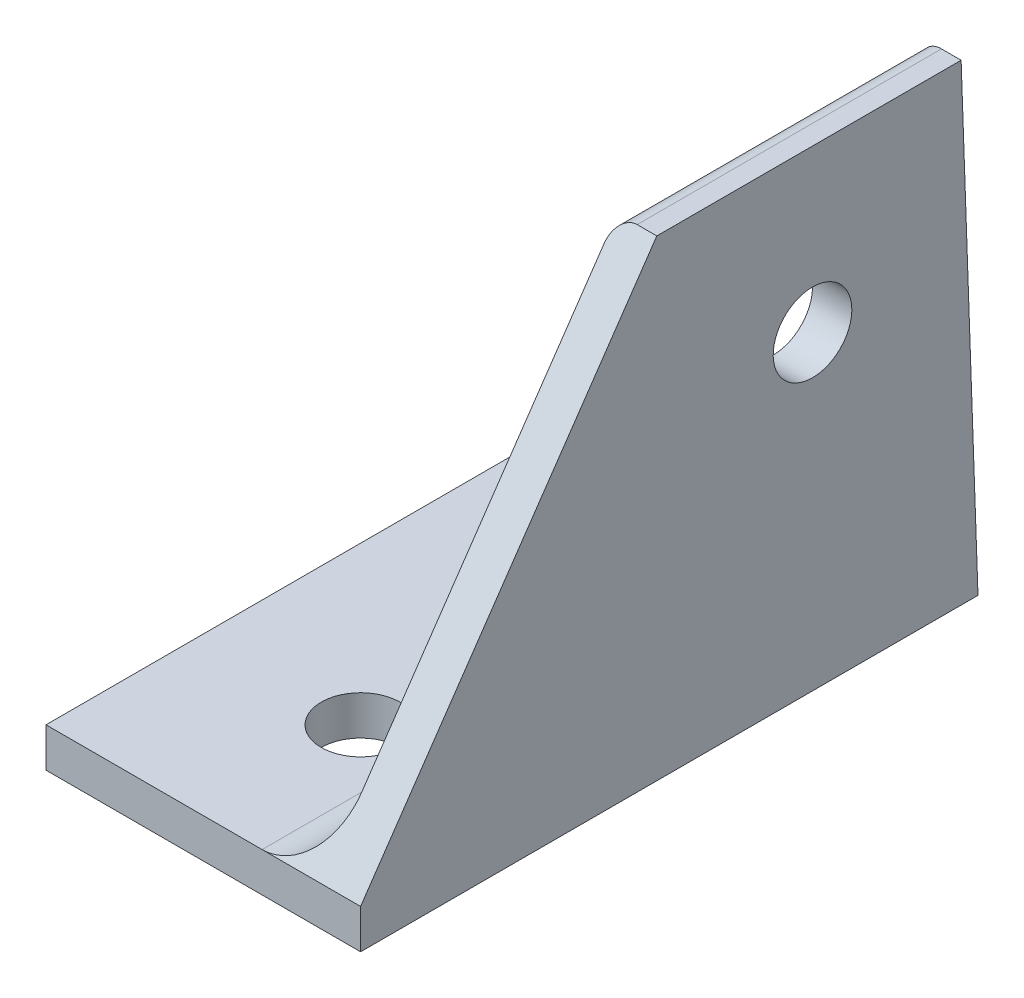
from build123d import *

# Parameters (mm, degrees)
BOSS_EXTRUDE1_DEPTH = 25.4
SKETCH3_R           = 3.175
SKETCH3_W           = 12.7
SKETCH3_H           = 50.8
CUT_EXTRUDE1_DEPTH  = 50.595085442
SKETCH12_OUTSIDE_W  = 66.478
SKETCH12_OUTSIDE_H  = 53.778
CUT_EXTRUDE2_DEPTH  = 41.659838908
SKETCH13_R          = 3.175
CUT_EXTRUDE3_DEPTH  = 41.659838908
SKETCH14_R          = 6.35
CUT_EXTRUDE4_DEPTH  = 2.54


with BuildPart() as part:
    # Sketch2 → Boss-Extrude1 (new, symmetric)
    with BuildSketch(Plane.XY):
        with BuildLine():
            Line((-19.05, -19.05), (19.05, -19.05))
            Line((19.05, -19.05), (19.05, 19.05))
            Line((19.05, 19.05), (17.4625, 19.05))
            ThreePointArc((17.4625, 19.05), (16.339967985, 18.585032015), (15.875, 17.4625))
            Line((15.875, 17.4625), (15.875, -11.0998))
            ThreePointArc((15.875, -11.0998), (14.476376302, -14.476376302), (11.0998, -15.875))
            Line((11.0998, -15.875), (-17.4625, -15.875))
            ThreePointArc((-17.4625, -15.875), (-18.585032015, -16.339967985), (-19.05, -17.4625))
            Line((-19.05, -17.4625), (-19.05, -19.05))
        make_face()
    extrude(amount=BOSS_EXTRUDE1_DEPTH, both=True)

    # Sketch3 → Cut-Extrude1 (cut, through all)
    with BuildSketch(Plane.XZ.offset(19.05)):
        with Locations((6.35, 12.7)):
            Circle(SKETCH3_R)
        with Locations((6.35, -12.7)):
            Circle(SKETCH3_R)
        with Locations((-12.7, 0)):
            Rectangle(SKETCH3_W, SKETCH3_H)
    extrude(amount=-CUT_EXTRUDE1_DEPTH, mode=Mode.SUBTRACT)

    # Sketch12 outside → Cut-Extrude2 (cut, through all)
    with BuildSketch(Plane(origin=(19.05, 0, 0), x_dir=(0, 0, -1), z_dir=(1, 0, 0))):
        Rectangle(SKETCH12_OUTSIDE_W, SKETCH12_OUTSIDE_H)
        Polygon((23.087203004, 19.05), (24.449518438, -19.05), (-25.4, -19.05), (-25.4, -15.875), (-1.48415665, 19.05), align=None, mode=Mode.SUBTRACT)
    extrude(amount=-CUT_EXTRUDE2_DEPTH, mode=Mode.SUBTRACT)

    # Sketch13 → Cut-Extrude3 (cut, through all)
    with BuildSketch(Plane(origin=(19.05, 0, 0), x_dir=(0, 0, -1), z_dir=(1, 0, 0))):
        with Locations(Location((11.088634042, 6.021904729, 0), (0, 0, 90))):
            Circle(SKETCH13_R)
    extrude(amount=-CUT_EXTRUDE3_DEPTH, mode=Mode.SUBTRACT)

    # Sketch14 → Cut-Extrude4 (cut)
    with BuildSketch(Plane(origin=(0, -15.875, 0), x_dir=(1, 0, 0), z_dir=(0, 1, 0))):
        with Locations((6.35, -12.7)):
            Circle(SKETCH14_R)
        with Locations((6.35, 12.7)):
            Circle(SKETCH14_R)
    extrude(amount=CUT_EXTRUDE4_DEPTH, mode=Mode.SUBTRACT)


solid = part.part
